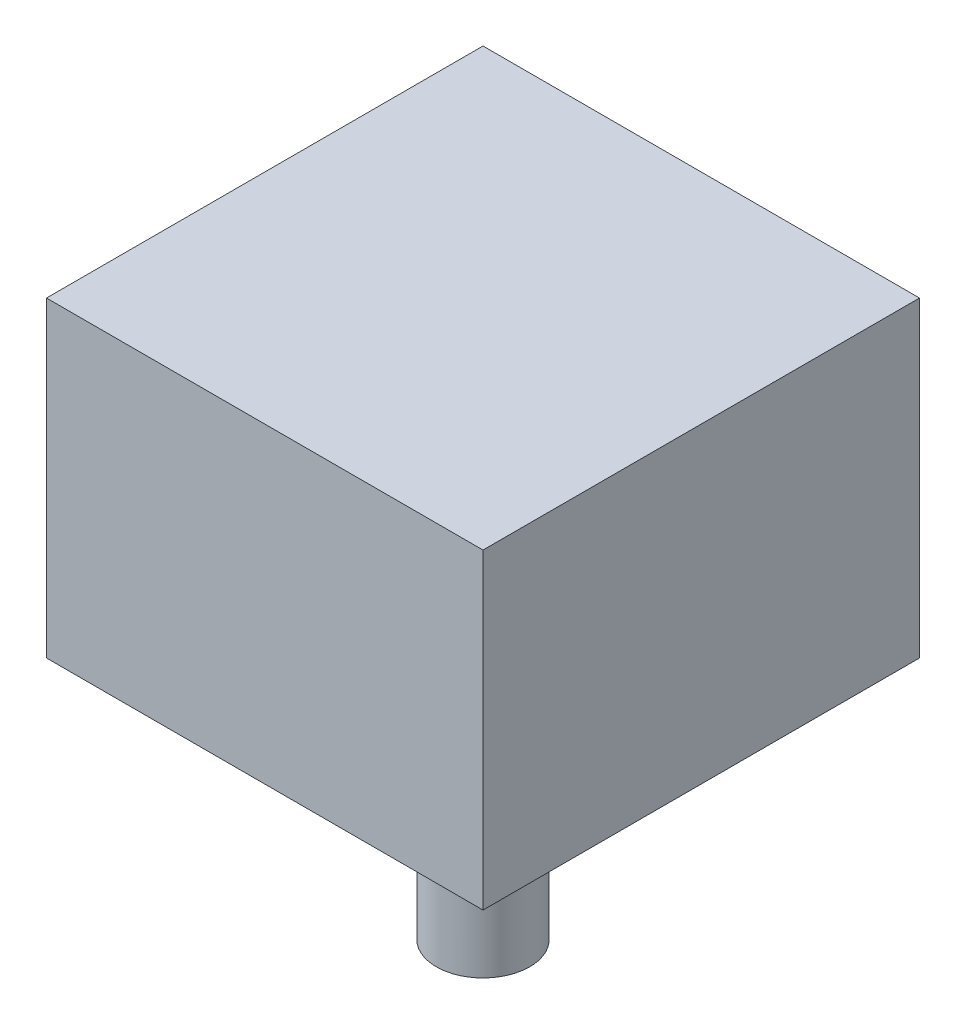
from build123d import *

# Parameters (mm, degrees)
SKETCH1_W               = 28
SKETCH1_H               = 28
BOSS_EXTRUDE1_DEPTH     = 10
CUT_EXTRUDE1_DEPTH      = 41.473357958
CUT_EXTRUDE1_DEPTH_BACK = 41.473357958
SKETCH4_R               = 1.55


with BuildPart() as part:
    # Sketch1 → Boss-Extrude1 (new, symmetric)
    with BuildSketch(Plane(origin=(0, 0, 0), x_dir=(1, 0, 0), z_dir=(0, 1, 0))):
        Rectangle(SKETCH1_W, SKETCH1_H)
    extrude(amount=BOSS_EXTRUDE1_DEPTH, both=True)

    # Sketch2 → Cut-Revolve1 (revolve, cut)
    with BuildSketch(Plane.XY):
        with BuildLine():
            Line((0, -15), (0, -1))
            ThreePointArc((0, -1), (7, -8), (0, -15))
        make_face()
    revolve(axis=Axis((0, -15, 0), (0, 1, 0)), mode=Mode.SUBTRACT)


with BuildPart() as body_2:
    # Sketch3 → Revolve1 (revolve)
    with BuildSketch(Plane.XY, mode=Mode.PRIVATE) as revolve1_sk:
        with BuildLine():
            Line((0, -1.6), (0, -14.4))
            Line((0, -14.4), (0, -25.65331761))
            Line((0, -25.65331761), (3, -25.65331761))
            Line((3, -25.65331761), (3, -13.65331761))
            ThreePointArc((3, -13.65331761), (6.210524644, -6.454236872), (0, -1.6))
        make_face()
    revolve(revolve1_sk.sketch.rotate(Axis((0, -15, 0), (0, 1, 0)), 90), axis=Axis((0, -15, 0), (0, 1, 0)))

    # Sketch4 → Cut-Extrude1 (cut, two sides: drawn at the far end of the back side and taken through both)
    with BuildSketch(Plane.XY.offset(14).offset(-CUT_EXTRUDE1_DEPTH_BACK)):
        with Locations((0, -17.65331761)):
            Circle(SKETCH4_R)
    extrude(amount=CUT_EXTRUDE1_DEPTH + CUT_EXTRUDE1_DEPTH_BACK, mode=Mode.SUBTRACT)


solid = Compound([part.part, body_2.part])
